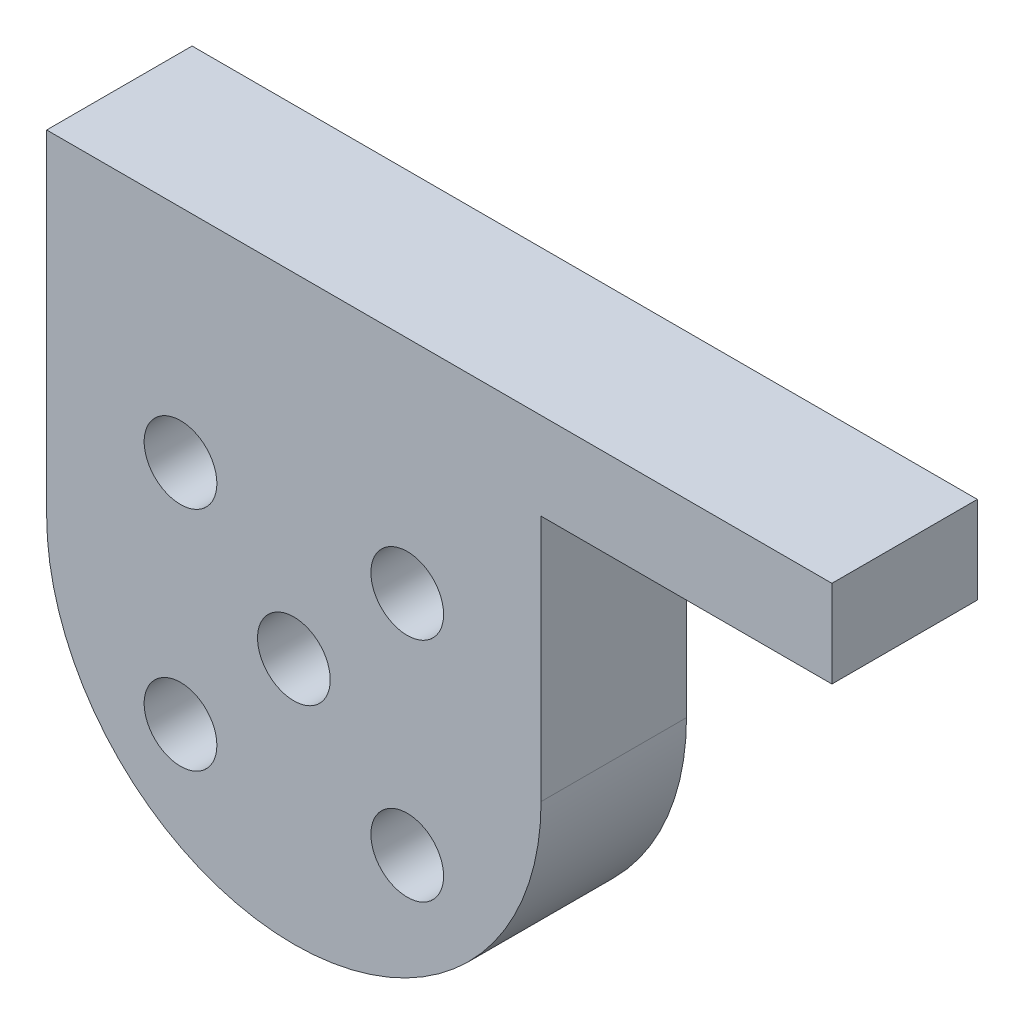
from build123d import *

# Parameters (mm, degrees)
SKETCH1_R           = 1.5875
BOSS_EXTRUDE1_DEPTH = 6.35


with BuildPart() as part:
    # Sketch1 → Boss-Extrude1 (new body)
    with BuildSketch(Plane.XY):
        with BuildLine():
            Line((10.795, 0), (10.795, 10.795))
            Line((10.795, 10.795), (23.495, 10.795))
            Line((23.495, 10.795), (23.495, 14.605))
            Line((23.495, 14.605), (-10.795, 14.605))
            Line((-10.795, 14.605), (-10.795, 0))
            ThreePointArc((-10.795, 0), (0, -10.795), (10.795, 0))
        make_face()
        Circle(SKETCH1_R, mode=Mode.SUBTRACT)
        with Locations((-4.95, 4.95)):
            Circle(SKETCH1_R, mode=Mode.SUBTRACT)
        with Locations((-4.95, -4.95)):
            Circle(SKETCH1_R, mode=Mode.SUBTRACT)
        with Locations((4.95, -4.95)):
            Circle(SKETCH1_R, mode=Mode.SUBTRACT)
        with Locations((4.95, 4.95)):
            Circle(SKETCH1_R, mode=Mode.SUBTRACT)
    extrude(amount=BOSS_EXTRUDE1_DEPTH)


solid = part.part
